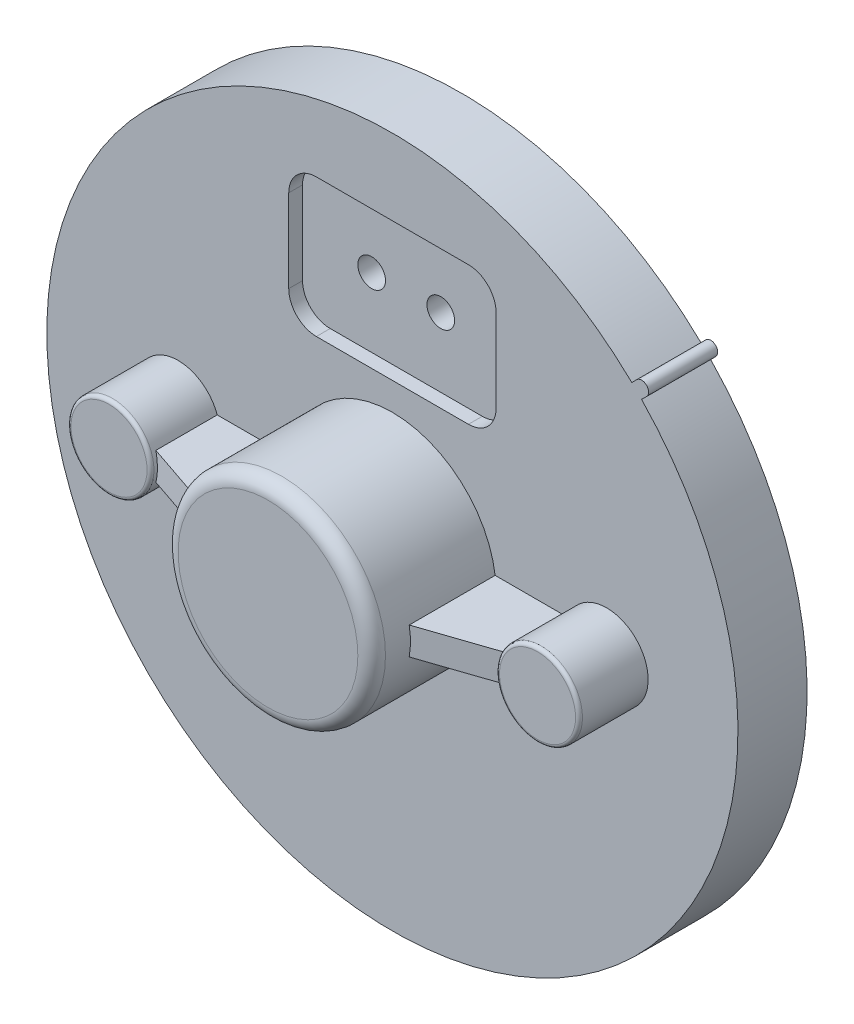
from build123d import *

# Parameters (mm, degrees)
SKETCH_1_R           = 25
EXTRUDE_1_DEPTH      = 5
SKETCH_2_R           = 7.5
EXTRUDE_2_DEPTH      = 9
SKETCH_3_R           = 3
EXTRUDE_3_DEPTH      = 5
FILLET_1_R           = 1
EXTRUDE_4_DEPTH      = 1
EXTRUDE_4_DEPTH_BACK = 1
FILLET_2_R           = 0.25
EXTRUDE_5_DEPTH      = 5
CUT_EXTRUDE_1_DEPTH  = 1
SKETCH_7_R           = 1
CUT_EXTRUDE_2_DEPTH  = 21


with BuildPart() as part:
    # Эскиз1 → Бобышка-Вытянуть1 (new body)
    with BuildSketch(Plane.XY):
        Circle(SKETCH_1_R)
    extrude(amount=EXTRUDE_1_DEPTH)

    # Эскиз2 → Бобышка-Вытянуть2 (add)
    with BuildSketch(Plane.XY.offset(5)):
        Circle(SKETCH_2_R)
    extrude(amount=EXTRUDE_2_DEPTH)

    # Эскиз3 → Бобышка-Вытянуть3 (add)
    with BuildSketch(Plane.XY.offset(5)):
        with Locations((15.5, 0)):
            Circle(SKETCH_3_R)
        with Locations((-15.5, 0)):
            Circle(SKETCH_3_R)
    extrude(amount=EXTRUDE_3_DEPTH)

    # Скругление1
    fillet_1_edges = [part.edges().sort_by_distance(p)[0] for p in [
        (-7.5, 0, 14),
    ]]
    fillet(fillet_1_edges, radius=FILLET_1_R)

    # Эскиз4 → Бобышка-Вытянуть4 (add, two sides: drawn at the far end of the back side and taken through both)
    with BuildSketch(Plane(origin=(0, 0, 0), x_dir=(1, 0, 0), z_dir=(0, 1, 0)).offset(-EXTRUDE_4_DEPTH_BACK)):
        Polygon((-15.889303471, -8.350739368), (-5.011906667, -12.039097177), (-5.011906667, -5), (-15.889303471, -5), align=None)
        Polygon((5.011906667, -12.039097177), (5.011906667, -5), (15.889303471, -5), (15.889303471, -8.350739368), align=None)
    extrude(amount=EXTRUDE_4_DEPTH + EXTRUDE_4_DEPTH_BACK)

    # Скругление2
    fillet_2_edges = [part.edges().sort_by_distance(p)[0] for p in [
        (-18.5, 0, 10),
        (12.5, 0, 10),
    ]]
    fillet(fillet_2_edges, radius=FILLET_2_R)

    # Эскиз5 → Бобышка-Вытянуть5 (add)
    with BuildSketch(Plane.XY.offset(5)):
        with BuildLine():
            Line((17.67766953, 18.384776311), (17.015216986, 17.722323767))
            Line((17.015216986, 17.722323767), (17.709176341, 17.028364412))
            Line((17.709176341, 17.028364412), (18.377652971, 17.670686903))
            ThreePointArc((18.377652971, 17.670686903), (18.388285388, 18.381232054), (17.67766953, 18.384776311))
        make_face()
    extrude(amount=-EXTRUDE_5_DEPTH)

    # Эскиз6 → Вырез-Вытянуть1 (cut)
    with BuildSketch(Plane.XY.offset(5)):
        with BuildLine():
            Line((-5.5, 9.5), (5.5, 9.5))
            ThreePointArc((5.5, 9.5), (6.914213562, 10.085786438), (7.5, 11.5))
            Line((7.5, 11.5), (7.5, 17.5))
            ThreePointArc((7.5, 17.5), (6.914213562, 18.914213562), (5.5, 19.5))
            Line((5.5, 19.5), (-5.5, 19.5))
            ThreePointArc((-5.5, 19.5), (-6.914213562, 18.914213562), (-7.5, 17.5))
            Line((-7.5, 17.5), (-7.5, 11.5))
            ThreePointArc((-7.5, 11.5), (-6.914213562, 10.085786438), (-5.5, 9.5))
        make_face()
    extrude(amount=-CUT_EXTRUDE_1_DEPTH, mode=Mode.SUBTRACT)

    # Эскиз7 → Вырез-Вытянуть2 (cut)
    with BuildSketch(Plane.XY.offset(4)):
        with Locations((-2.5, 14.5)):
            Circle(SKETCH_7_R)
        with Locations((2.5, 14.5)):
            Circle(SKETCH_7_R)
    extrude(amount=-CUT_EXTRUDE_2_DEPTH, mode=Mode.SUBTRACT)


solid = part.part
